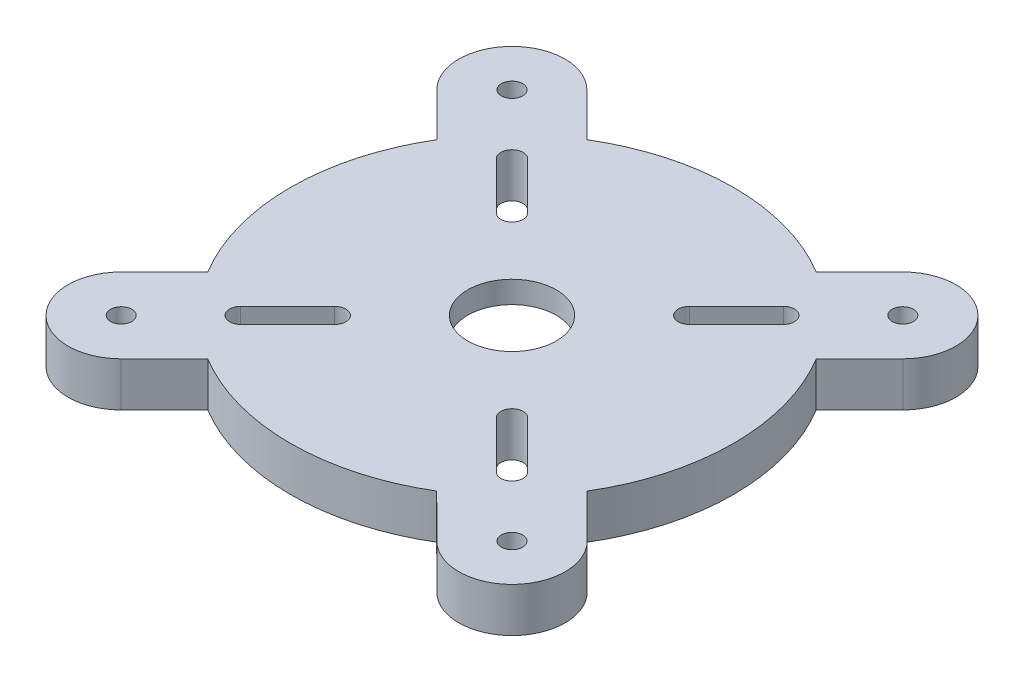
from build123d import *

# Parameters (mm, degrees)
SKETCH2_R           = 2.4
BOSS_EXTRUDE1_DEPTH = 10
SKETCH3_R           = 22
CUT_EXTRUDE1_DEPTH  = 5.03
SKETCH5_R           = 10
CUT_EXTRUDE4_DEPTH  = 5.03


with BuildPart() as part:
    # Sketch2 → Boss-Extrude1 (new body)
    with BuildSketch(Plane(origin=(0, 0, 0), x_dir=(1, 0, 0), z_dir=(0, 1, 0))):
        with BuildLine():
            ThreePointArc((52.570951393, 35.600388644), (52.570951393, 52.570951393), (35.600388644, 52.570951393))
            Line((35.600388644, 52.570951393), (25.836723229, 42.807285978))
            ThreePointArc((25.836723229, 42.807285978), (-0.031141312, 49.999990302), (-25.890026175, 42.775069195))
            Line((-25.890026175, 42.775069195), (-35.685908373, 52.570951393))
            ThreePointArc((-35.685908373, 52.570951393), (-39.559243335, 55.164025054), (-44.128429883, 56.085593835))
            ThreePointArc((-44.128429883, 56.085593835), (-55.180388571, 48.658111405), (-52.570951393, 35.600388644))
            Line((-52.570951393, 35.600388644), (-42.807285978, 25.836723229))
            ThreePointArc((-42.807285978, 25.836723229), (-50, 0), (-42.807285978, -25.836723229))
            Line((-42.807285978, -25.836723229), (-52.570951393, -35.600388644))
            ThreePointArc((-52.570951393, -35.600388644), (-52.570951393, -52.570951393), (-35.600388644, -52.570951393))
            Line((-35.600388644, -52.570951393), (-25.836723229, -42.807285978))
            ThreePointArc((-25.836723229, -42.807285978), (-0.031150905, -49.999990296), (25.783363755, -42.839446232))
            Line((25.783363755, -42.839446232), (27.246595152, -44.30267763))
            ThreePointArc((27.246595152, -44.30267763), (27.683219954, -44.717909015), (28.140137338, -45.110700086))
            Line((28.140137338, -45.110700086), (35.600388644, -52.570951393))
            ThreePointArc((35.600388644, -52.570951393), (52.570951393, -52.570951393), (52.570951393, -35.600388644))
            Line((52.570951393, -35.600388644), (42.807285978, -25.836723229))
            ThreePointArc((42.807285978, -25.836723229), (50, 0), (42.807285978, 25.836723229))
            Line((42.807285978, 25.836723229), (52.570951393, 35.600388644))
        make_face()
        with Locations(Location((-44.085670018, -44.085670018, 0), (0, 0, 270))):
            Circle(SKETCH2_R, mode=Mode.SUBTRACT)
        with BuildLine():
            Line((-18.232233047, -21.767766953), (-28.838834765, -32.374368671))
            ThreePointArc((-28.838834765, -32.374368671), (-32.374368671, -32.374368671), (-32.374368671, -28.838834765))
            Line((-32.374368671, -28.838834765), (-21.767766953, -18.232233047))
            ThreePointArc((-21.767766953, -18.232233047), (-18.232233047, -18.232233047), (-18.232233047, -21.767766953))
        make_face(mode=Mode.SUBTRACT)
        with Locations(Location((44.088384567, -44.088356778, 0), (0, 0, 270))):
            Circle(SKETCH2_R, mode=Mode.SUBTRACT)
        with BuildLine():
            ThreePointArc((32.374368671, -28.838834765), (32.374368671, -32.374368671), (28.838834765, -32.374368671))
            Line((28.838834765, -32.374368671), (18.232233047, -21.767766953))
            ThreePointArc((18.232233047, -21.767766953), (18.232233047, -18.232233047), (21.767766953, -18.232233047))
            Line((21.767766953, -18.232233047), (32.374368671, -28.838834765))
        make_face(mode=Mode.SUBTRACT)
        with BuildLine():
            ThreePointArc((-32.374368671, 28.838834765), (-32.374368671, 32.374368671), (-28.838834765, 32.374368671))
            Line((-28.838834765, 32.374368671), (-18.232233047, 21.767766953))
            ThreePointArc((-18.232233047, 21.767766953), (-18.232233047, 18.232233047), (-21.767766953, 18.232233047))
            Line((-21.767766953, 18.232233047), (-32.374368671, 28.838834765))
        make_face(mode=Mode.SUBTRACT)
        with Locations(Location((-44.085670018, 44.085670018, 0), (0, 0, 270))):
            Circle(SKETCH2_R, mode=Mode.SUBTRACT)
        with BuildLine():
            Line((18.232233047, 21.767766953), (28.838834765, 32.374368671))
            ThreePointArc((28.838834765, 32.374368671), (32.374368671, 32.374368671), (32.374368671, 28.838834765))
            Line((32.374368671, 28.838834765), (21.767766953, 18.232233047))
            ThreePointArc((21.767766953, 18.232233047), (18.232233047, 18.232233047), (18.232233047, 21.767766953))
        make_face(mode=Mode.SUBTRACT)
        with Locations(Location((44.085670018, 44.085670018, 0), (0, 0, 270))):
            Circle(SKETCH2_R, mode=Mode.SUBTRACT)
    extrude(amount=BOSS_EXTRUDE1_DEPTH)

    # Sketch3 → Cut-Extrude1 (cut)
    with BuildSketch(Plane(origin=(0, 0, 0), x_dir=(-1, 0, 0), z_dir=(0, -1, 0))):
        with Locations(Location((0, 0, 0), (0, 0, 90))):
            Circle(SKETCH3_R)
    extrude(amount=-CUT_EXTRUDE1_DEPTH, mode=Mode.SUBTRACT)

    # Sketch5 → Cut-Extrude4 (cut)
    with BuildSketch(Plane(origin=(0, 10, 0), x_dir=(1, 0, 0), z_dir=(0, 1, 0))):
        with Locations(Location((0, 0, 0), (0, 0, 270))):
            Circle(SKETCH5_R)
    extrude(amount=-CUT_EXTRUDE4_DEPTH, mode=Mode.SUBTRACT)


solid = part.part
